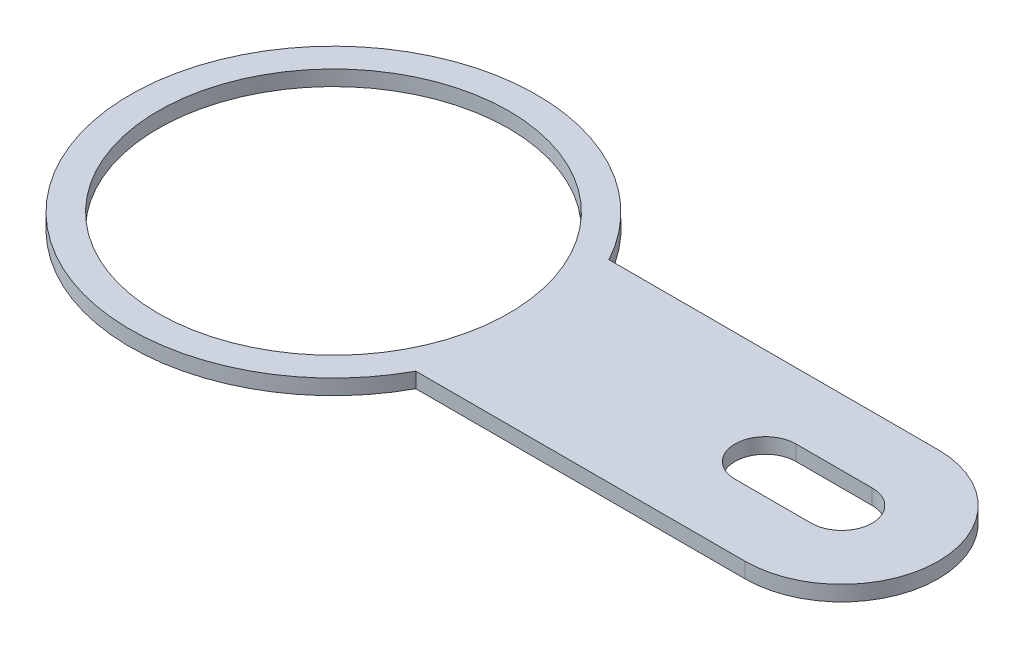
from build123d import *

# Parameters (mm, degrees)
SKETCH_1_R      = 3.45
EXTRUDE_1_DEPTH = 0.3


with BuildPart() as part:
    # 草图1 → 凸台-拉伸1 (new body)
    with BuildSketch(Plane(origin=(0, 0, 0), x_dir=(1, 0, 0), z_dir=(0, 1, 0))):
        with BuildLine():
            Line((3.519943181, 1.9), (10, 1.9))
            ThreePointArc((10, 1.9), (11.9, 0), (10, -1.9))
            Line((10, -1.9), (3.519943181, -1.9))
            ThreePointArc((3.519943181, -1.9), (-4, 0), (3.519943181, 1.9))
        make_face()
        with Locations(Location((0, 0, 0), (0, 0, 270))):
            Circle(SKETCH_1_R, mode=Mode.SUBTRACT)
        with BuildLine():
            Line((10, -0.6), (8.5, -0.6))
            ThreePointArc((8.5, -0.6), (7.9, 0), (8.5, 0.6))
            Line((8.5, 0.6), (10, 0.6))
            ThreePointArc((10, 0.6), (10.6, 0), (10, -0.6))
        make_face(mode=Mode.SUBTRACT)
    extrude(amount=EXTRUDE_1_DEPTH)


solid = part.part
